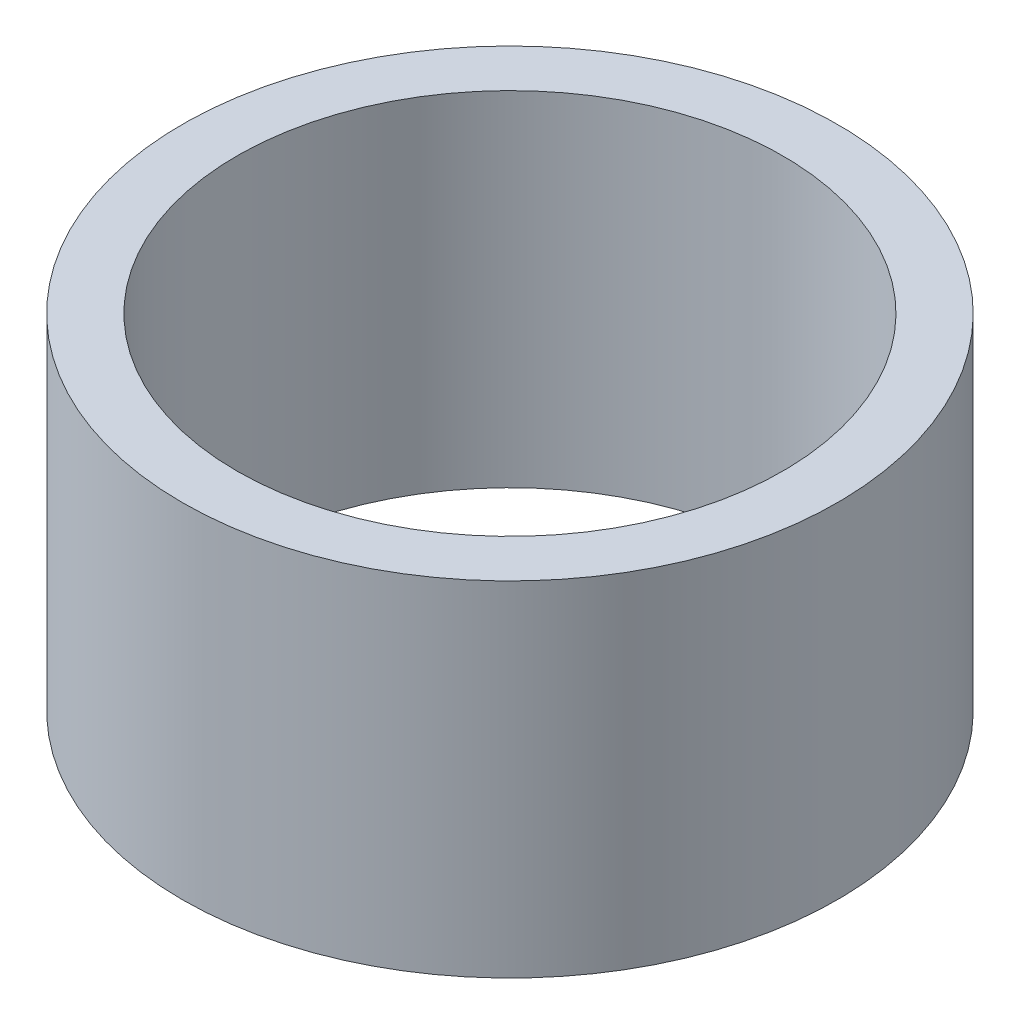
from build123d import *

# Parameters (mm, degrees)
SKETCH1_R           = 4.7625
SKETCH1_R_2         = 3.96875
BOSS_EXTRUDE1_DEPTH = 5


with BuildPart() as part:
    # Sketch1 → Boss-Extrude1 (new body)
    with BuildSketch(Plane(origin=(0, 0, 0), x_dir=(1, 0, 0), z_dir=(0, 1, 0))):
        with Locations(Location((0, 0, 0), (0, 0, 270))):
            Circle(SKETCH1_R)
        with Locations(Location((0, 0, 0), (0, 0, 270))):
            Circle(SKETCH1_R_2, mode=Mode.SUBTRACT)
    extrude(amount=BOSS_EXTRUDE1_DEPTH)


solid = part.part
